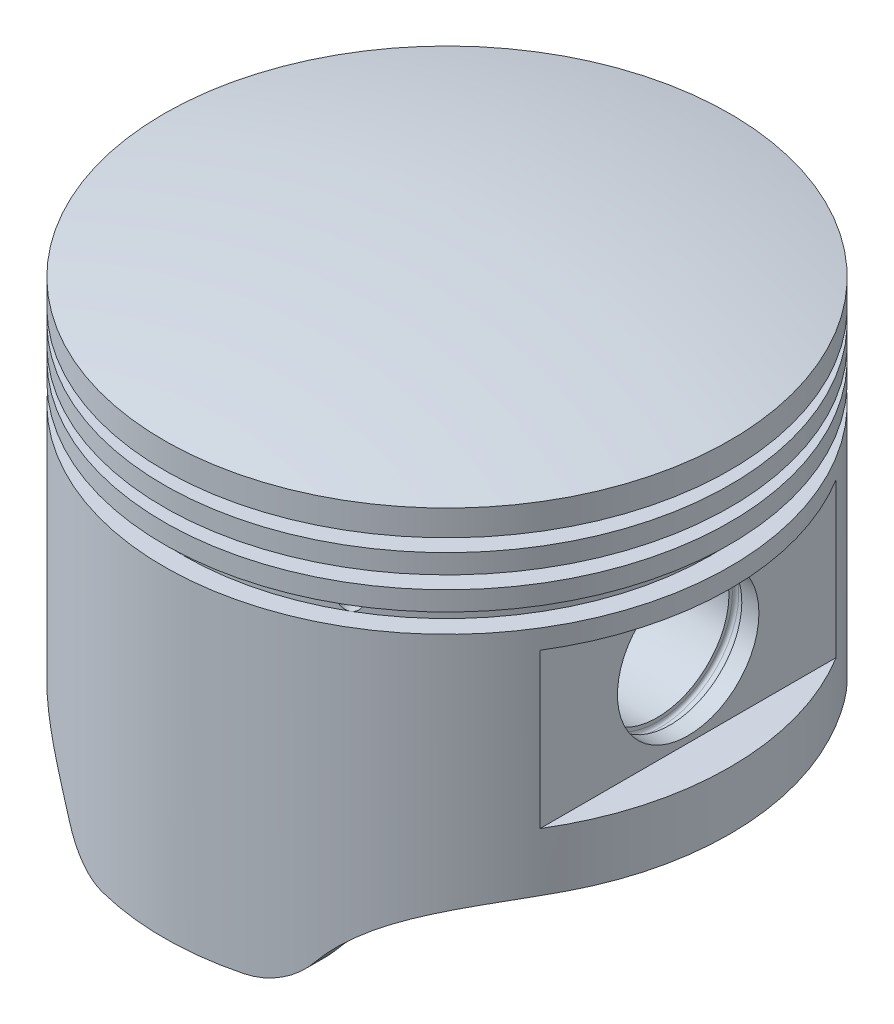
from build123d import *
from build123d.topology import SkipClean

# Parameters (mm, degrees)
CUT_EXTRUDE1_DEPTH      = 92.438503925
CUT_EXTRUDE1_DEPTH_BACK = 92.438503925
SKETCH2_W               = 13
SKETCH2_H               = 24
BOSS_EXTRUDE1_START     = 39
BOSS_EXTRUDE1_DEPTH     = 39
BOSS_EXTRUDE2_DEPTH     = 10
SKETCH6_R               = 11
CUT_EXTRUDE2_DEPTH      = 115.312072853
FILLET1_R               = 2
DOME1_FACE_RADIUS       = 44
DOME1_HEIGHT            = 5
CUT_EXTRUDE3_DEPTH      = 96.163018027
CUT_EXTRUDE3_DEPTH_BACK = 96.163018027
FILLET2_R               = 10
SKETCH9_R               = 1.5
CUT_EXTRUDE5_DEPTH      = 96.163018119
CIRPATTERN1_COUNT       = 12


with BuildPart() as part:
    # Sketch1 → Revolve1 (revolve)
    with BuildSketch(Plane.XY, mode=Mode.PRIVATE) as revolve1_sk:
        Polygon((41, 0), (44, 0), (44, 50), (41, 50), (41, 53), (44, 53), (44, 56), (41, 56), (41, 58), (44, 58), (44, 61), (41, 61), (41, 63), (44, 63), (44, 67), (0, 67), (0, 59), (36, 59), (36, 20), (41, 20), align=None)
    revolve(revolve1_sk.sketch.rotate(Axis((0, 59, 0), (0, -1, 0)), 180), axis=Axis((0, 59, 0), (0, -1, 0)))

    # Sketch2 → Cut-Extrude1 (cut, two sides: drawn at the far end of the back side and taken through both)
    with BuildSketch(Plane.XY.offset(-CUT_EXTRUDE1_DEPTH_BACK)):
        with Locations((-44, 35)):
            Rectangle(SKETCH2_W, SKETCH2_H)
        with Locations((44, 35)):
            Rectangle(SKETCH2_W, SKETCH2_H)
    extrude(amount=CUT_EXTRUDE1_DEPTH + CUT_EXTRUDE1_DEPTH_BACK, mode=Mode.SUBTRACT)

    # Sketch3 → Boss-Extrude1 (add)
    with BuildSketch(Plane.XZ.offset(-59).offset(BOSS_EXTRUDE1_START)):
        with BuildLine():
            Line((-30, -19.899748742), (-30, 19.899748742))
            ThreePointArc((-30, 19.899748742), (-36, 0), (-30, -19.899748742))
        make_face()
        with BuildLine():
            ThreePointArc((36, 0), (34.467375879, 10.392304845), (30, 19.899748742))
            Line((30, 19.899748742), (30, -19.899748742))
            ThreePointArc((30, -19.899748742), (34.467375879, -10.392304845), (36, 0))
        make_face()
    extrude(amount=-BOSS_EXTRUDE1_DEPTH)

    # Sketch5 → Boss-Extrude2 (add)
    with BuildSketch(Plane(origin=(-30, 0, 0), x_dir=(0, 0, -1), z_dir=(1, 0, 0))):
        with BuildLine():
            Line((15, 35), (15, 59))
            Line((15, 59), (-15, 59))
            Line((-15, 59), (-15, 35))
            ThreePointArc((-15, 35), (0, 20), (15, 35))
        make_face()
    boss_extrude2 = extrude(amount=BOSS_EXTRUDE2_DEPTH)

    # Mirror1: Boss-Extrude2 across plane
    add(boss_extrude2.mirror(Plane(origin=(0, 0, 0), x_dir=(0, 0, 1), z_dir=(1, 0, 0))))

    # Sketch6 → Cut-Extrude2 (cut, through all)
    with BuildSketch(Plane(origin=(37.5, 0, 0), x_dir=(0, 0, -1), z_dir=(1, 0, 0))):
        with Locations((0, 35)):
            Circle(SKETCH6_R)
    extrude(amount=-CUT_EXTRUDE2_DEPTH, mode=Mode.SUBTRACT)

    # Fillet1
    fillet1_edges = [part.edges().sort_by_distance(p)[0] for p in [
        (-20, 47, -15),
        (-20, 47, 15),
        (-20, 20, 0),
        (20, 47, 15),
        (20, 20, 0),
        (20, 47, -15),
    ]]
    fillet(fillet1_edges, radius=FILLET1_R)

    # Dome1: a dome of height H over a round flat face of radius A is a cap of a sphere of radius (A * A + H * H) / (2 * H)
    dome1_r = (DOME1_FACE_RADIUS * DOME1_FACE_RADIUS + DOME1_HEIGHT * DOME1_HEIGHT) / (2 * DOME1_HEIGHT)
    dome1_base = Plane((0, 67, 0), z_dir=(0, 1, 0))
    with Locations(dome1_base.offset(DOME1_HEIGHT - dome1_r)):
        dome1_ball = Sphere(dome1_r, mode=Mode.PRIVATE)
    add(split(dome1_ball, bisect_by=dome1_base, keep=Keep.TOP, mode=Mode.PRIVATE))

    # Sketch7 → Cut-Extrude3 (cut, two sides: drawn at the far end of the back side and taken through both)
    with BuildSketch(Plane.XY.offset(-CUT_EXTRUDE3_DEPTH_BACK)):
        with BuildLine():
            Line((-44, 0), (-44, 14))
            Line((-44, 14), (-39, 14))
            ThreePointArc((-39, 14), (-25.771243445, 10.213203436), (-16.550055679, 0))
            Line((-16.550055679, 0), (-44, 0))
        make_face()
        with BuildLine():
            Line((44, 0), (16.550055679, 0))
            ThreePointArc((16.550055679, 0), (25.771243445, 10.213203436), (39, 14))
            Line((39, 14), (44, 14))
            Line((44, 14), (44, 0))
        make_face()
    extrude(amount=CUT_EXTRUDE3_DEPTH + CUT_EXTRUDE3_DEPTH_BACK, mode=Mode.SUBTRACT)

    # Fillet2
    fillet2_edges = [part.edges().sort_by_distance(p)[0] for p in [
        (16.550055679, 0, -39.140040567),
        (16.550055679, 0, 39.140040567),
        (-16.550055679, 0, -39.140040567),
        (-16.550055679, 0, 39.140040567),
    ]]
    fillet(fillet2_edges, radius=FILLET2_R)

    # Sketch8 → Cut-Revolve1 (revolve, cut)
    with BuildSketch(Plane.XY):
        with BuildLine():
            Line((33.5, 47), (34.5, 47))
            ThreePointArc((34.5, 47), (34.853553391, 46.853553391), (35, 46.5))
            Line((35, 46.5), (35, 45.5))
            ThreePointArc((35, 45.5), (34.853553391, 45.146446609), (34.5, 45))
            Line((34.5, 45), (33.5, 45))
            ThreePointArc((33.5, 45), (33.146446609, 45.146446609), (33, 45.5))
            Line((33, 45.5), (33, 46.5))
            ThreePointArc((33, 46.5), (33.146446609, 46.853553391), (33.5, 47))
        make_face()
        with BuildLine():
            Line((-35, 46.5), (-35, 45.5))
            ThreePointArc((-35, 45.5), (-34.853553391, 45.146446609), (-34.5, 45))
            Line((-34.5, 45), (-33.5, 45))
            ThreePointArc((-33.5, 45), (-33.146446609, 45.146446609), (-33, 45.5))
            Line((-33, 45.5), (-33, 46.5))
            ThreePointArc((-33, 46.5), (-33.146446609, 46.853553391), (-33.5, 47))
            Line((-33.5, 47), (-34.5, 47))
            ThreePointArc((-34.5, 47), (-34.853553391, 46.853553391), (-35, 46.5))
        make_face()
    revolve(axis=Axis((30, 35, 0), (-0.9998874461082384, 0.015003170169821228, 0)), mode=Mode.SUBTRACT)

    # Sketch9 → Cut-Extrude5 (cut, through all)
    with SkipClean():  # the faces are left unmerged after this step: merging them gives an invalid solid
        with BuildSketch(Plane.XY):
            with Locations((0, 51.5)):
                Circle(SKETCH9_R)
        cut_extrude5 = extrude(amount=-CUT_EXTRUDE5_DEPTH, mode=Mode.SUBTRACT)

    # CirPattern1: Cut-Extrude5 ×12 about axis, 6 skipped
    cirpattern1_axis = Axis((0, 50, 0), (0, 1, 0))
    add([cut_extrude5.rotate(cirpattern1_axis, i * 360 / CIRPATTERN1_COUNT) for i in range(1, CIRPATTERN1_COUNT) if i not in (2, 3, 4, 8, 9, 10)], mode=Mode.SUBTRACT)


solid = part.part
